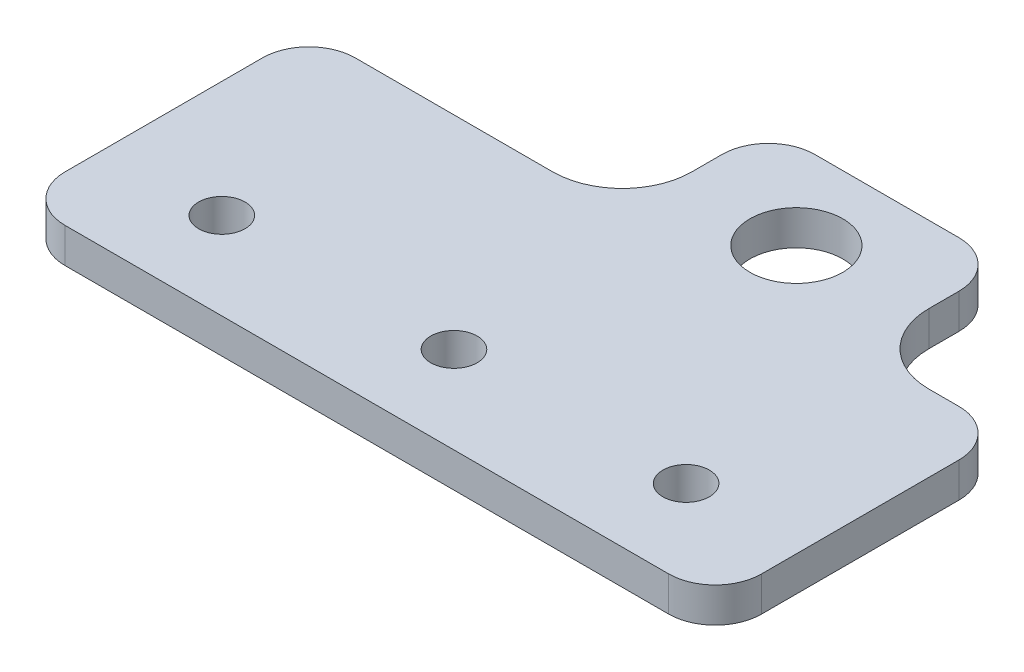
from build123d import *

# Parameters (mm, degrees)
SKETCH_1_W          = 60
SKETCH_1_H          = 25
SKETCH_1_R          = 2
EXTRUDE_1_DEPTH     = 3
SKETCH_2_R          = 4
CUT_EXTRUDE_1_DEPTH = 3
CUT_EXTRUDE_2_DEPTH = 10
FILLET_1_R          = 6
FILLET_2_R          = 4
FILLET_3_R          = 4


with BuildPart() as part:
    # 草图1 → 凸台-拉伸1 (new body)
    # profile 1 of 2: a face of its own
    with BuildSketch(Plane(origin=(0, 0, 0), x_dir=(1, 0, 0), z_dir=(0, 1, 0))):
        Rectangle(SKETCH_1_W, SKETCH_1_H)
        with Locations(Location((20, -5, 0), (0, 0, 270))):
            Circle(SKETCH_1_R, mode=Mode.SUBTRACT)
        with Locations(Location((-20, -5, 0), (0, 0, 270))):
            Circle(SKETCH_1_R, mode=Mode.SUBTRACT)
        with Locations(Location((0, -5, 0), (0, 0, 270))):
            Circle(SKETCH_1_R, mode=Mode.SUBTRACT)
    # profile 2 of 2: a face of its own
    with BuildSketch(Plane(origin=(0, 0, 0), x_dir=(1, 0, 0), z_dir=(0, 1, 0))):
        Polygon((10.919107028, 31.580892972), (30, 12.5), (-30, 12.5), align=None)
    extrude(amount=EXTRUDE_1_DEPTH)

    # 草图2 → 切除-拉伸1 (cut)
    with BuildSketch(Plane(origin=(0, 3, 0), x_dir=(1, 0, 0), z_dir=(0, 1, 0))):
        with Locations(Location((7, 17.5, 0), (0, 0, 270))):
            Circle(SKETCH_2_R)
    extrude(amount=-CUT_EXTRUDE_1_DEPTH, mode=Mode.SUBTRACT)

    # 草图3 → 切除-拉伸2 (cut)
    with BuildSketch(Plane(origin=(0, 3, 0), x_dir=(1, 0, 0), z_dir=(0, 1, 0))):
        Polygon((-3, 25.09030677), (-30, 12.5), (-3, 12.5), align=None)
        Polygon((10.919107028, 31.580892972), (-3, 25.09030677), (17.40969323, 25.09030677), align=None)
        Polygon((30, 12.5), (17.40969323, 25.09030677), (17.40969323, 12.5), align=None)
    extrude(amount=-CUT_EXTRUDE_2_DEPTH, mode=Mode.SUBTRACT)

    # 圆角1
    fillet_1_edges = [part.edges().sort_by_distance(p)[0] for p in [
        (-3, 1.5, -12.5),
        (17.40969323, 1.5, -12.5),
    ]]
    fillet(fillet_1_edges, radius=FILLET_1_R)

    # 圆角2
    fillet_2_edges = [part.edges().sort_by_distance(p)[0] for p in [
        (-3, 1.5, -25.09030677),
        (17.40969323, 1.5, -25.09030677),
    ]]
    fillet(fillet_2_edges, radius=FILLET_2_R)

    # 圆角3
    fillet_3_edges = [part.edges().sort_by_distance(p)[0] for p in [
        (30, 1.5, 12.5),
        (-30, 1.5, 12.5),
        (-30, 1.5, -12.5),
        (30, 1.5, -12.5),
    ]]
    fillet(fillet_3_edges, radius=FILLET_3_R)


solid = part.part
